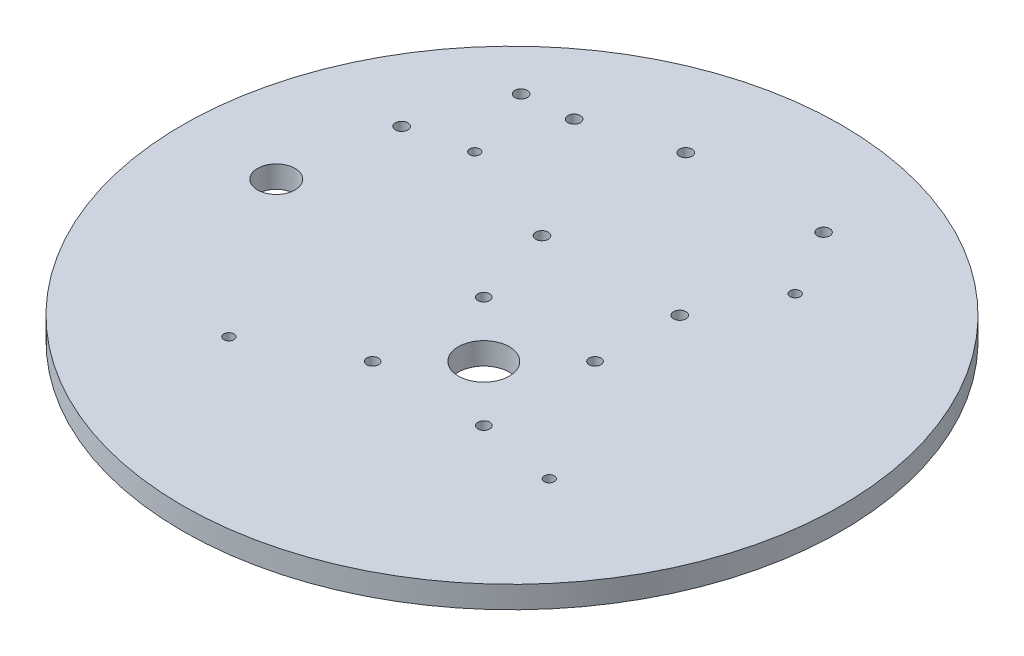
from build123d import *

# Parameters (mm, degrees)
SKETCH1_R                                        = 139.7
BOSS_EXTRUDE1_DEPTH                              = 6.35
SKETCH2_R                                        = 134.112
BOSS_EXTRUDE2_DEPTH                              = 3
BOSS_EXTRUDE3_DEPTH                              = 5
SKETCH37_R                                       = 177.8
CUT_EXTRUDE1_DEPTH                               = 268.317994245
CBORE_FOR_M4_HEX_HEAD_MACHINE_SCREW3_D           = 4.3
CBORE_FOR_M4_HEX_HEAD_MACHINE_SCREW3_CBORE_D     = 10.59
CBORE_FOR_M4_HEX_HEAD_MACHINE_SCREW3_CBORE_DEPTH = 3
CIRPATTERN1_COUNT                                = 4
F_5_8_0_625_DIAMETER_HOLE1_D                     = 15.875
SKETCH73_R                                       = 139.7
SKETCH73_R_2                                     = 134.112
BOSS_EXTRUDE4_DEPTH                              = 3
SKETCH74_R                                       = 3.81
SKETCH74_R_2                                     = 2.5
CUT_EXTRUDE5_DEPTH                               = 198.786760174
SKETCH75_R                                       = 21.59
CUT_EXTRUDE6_DEPTH                               = 1.8
SKETCH76_R                                       = 10.795
CUT_EXTRUDE7_DEPTH                               = 198.786760174
CBORE_FOR_M5_HEX_HEAD_MACHINE_SCREW1_D           = 5.3
CBORE_FOR_M5_HEX_HEAD_MACHINE_SCREW1_CBORE_D     = 11.71
CBORE_FOR_M5_HEX_HEAD_MACHINE_SCREW1_CBORE_DEPTH = 3.8
CBORE_FOR_M5_HEX_HEAD_BOLT1_D                    = 5.3
CBORE_FOR_M5_HEX_HEAD_BOLT1_CBORE_D              = 12.24
CBORE_FOR_M5_HEX_HEAD_BOLT1_CBORE_DEPTH          = 3.58
SKETCH84_R                                       = 5.855
BOSS_EXTRUDE6_DEPTH                              = 9.35
SKETCH85_R                                       = 5.295
SKETCH85_R_2                                     = 2.15
SKETCH85_R_3                                     = 21.59
SKETCH85_R_4                                     = 10.795
BOSS_EXTRUDE7_DEPTH                              = 3


with BuildPart() as part:
    # Sketch1 → Boss-Extrude1 (new body)
    with BuildSketch(Plane(origin=(0, 0, 0), x_dir=(1, 0, 0), z_dir=(0, 1, 0))):
        with Locations(Location((0, 0, 0), (0, 0, 270))):
            Circle(SKETCH1_R)
    extrude(amount=BOSS_EXTRUDE1_DEPTH)

    # Sketch2 → Boss-Extrude2 (add)
    with BuildSketch(Plane.XZ):
        with Locations(Location((0, 0, 0), (0, 0, 270))):
            Circle(SKETCH2_R)
    extrude(amount=BOSS_EXTRUDE2_DEPTH)

    # Sketch3 → Boss-Extrude3 (add, symmetric)
    with BuildSketch(Plane.XY):
        with BuildLine():
            Line((-38.1, 95.25), (-38.1, 6.35))
            Line((-38.1, 6.35), (-139.7, 6.35))
            Line((-139.7, 6.35), (-164.11656703, 72.845121962))
            ThreePointArc((-164.11656703, 72.845121962), (-114.47811829, 159.246393895), (-38.1, 95.25))
        make_face()
    extrude(amount=BOSS_EXTRUDE3_DEPTH, both=True)

    # Sketch37 → Cut-Extrude1 (cut, through all)
    with BuildSketch(Plane(origin=(0, 6.35, 0), x_dir=(1, 0, 0), z_dir=(0, 1, 0))):
        Circle(SKETCH37_R)
    extrude(amount=CUT_EXTRUDE1_DEPTH, mode=Mode.SUBTRACT)

    # CBORE for M4 Hex Head Machine Screw3 (through all)
    with Locations(Plane(origin=(0, 6.35, 0), x_dir=(1, 0, 0), z_dir=(0, 1, 0))):
        with Locations((52.109857404, 67.910888344)):
            cbore_for_m4_hex_head_machine_screw3 = CounterBoreHole(CBORE_FOR_M4_HEX_HEAD_MACHINE_SCREW3_D / 2, CBORE_FOR_M4_HEX_HEAD_MACHINE_SCREW3_CBORE_D / 2, CBORE_FOR_M4_HEX_HEAD_MACHINE_SCREW3_CBORE_DEPTH)

    # CirPattern1: CBORE for M4 Hex Head Machine Screw3 ×4 about axis
    cirpattern1_axis = Axis((0, 0, 0), (0, 1, 0))
    for i in range(1, CIRPATTERN1_COUNT):
        add(cbore_for_m4_hex_head_machine_screw3.rotate(cirpattern1_axis, i * 360 / CIRPATTERN1_COUNT), mode=Mode.SUBTRACT)

    # 5/8 (0.625) Diameter Hole1 (through all)
    with Locations(Plane(origin=(0, 6.35, 0), x_dir=(1, 0, 0), z_dir=(0, 1, 0))):
        with Locations((-99.914329603, 0)):
            Hole(F_5_8_0_625_DIAMETER_HOLE1_D / 2)

    # Sketch73 → Boss-Extrude4 (add)
    with BuildSketch(Plane.XZ):
        with Locations(Location((0, 0, 0), (0, 0, 270))):
            Circle(SKETCH73_R)
        Circle(SKETCH73_R_2, mode=Mode.SUBTRACT)
    extrude(amount=BOSS_EXTRUDE4_DEPTH)

    # Sketch74 → Cut-Extrude5 (cut, through all)
    with BuildSketch(Plane(origin=(0, 6.35, 0), x_dir=(1, 0, 0), z_dir=(0, 1, 0))):
        with Locations(Location((10.959973331, -22.913729172, 0), (0, 0, 270))):
            Circle(SKETCH74_R)
        with Locations(Location((34.529973331, -46.483729172, 0), (0, 0, 270))):
            Circle(SKETCH74_R_2)
        with Locations(Location((-12.610026669, -46.483729172, 0), (0, 0, 270))):
            Circle(SKETCH74_R_2)
        with Locations(Location((-12.610026669, 0.656270828, 0), (0, 0, 270))):
            Circle(SKETCH74_R_2)
        with Locations(Location((34.529973331, 0.656270828, 0), (0, 0, 270))):
            Circle(SKETCH74_R_2)
    extrude(amount=-CUT_EXTRUDE5_DEPTH, mode=Mode.SUBTRACT)

    # Sketch75 → Cut-Extrude6 (cut)
    with BuildSketch(Plane(origin=(0, 6.35, 0), x_dir=(1, 0, 0), z_dir=(0, 1, 0))):
        with Locations(Location((10.959973331, -22.913729172, 0), (0, 0, 270))):
            Circle(SKETCH75_R)
    extrude(amount=-CUT_EXTRUDE6_DEPTH, mode=Mode.SUBTRACT)

    # Sketch76 → Cut-Extrude7 (cut, through all)
    with BuildSketch(Plane.XZ.offset(3)):
        with Locations(Location((10.959973331, 22.913729172, 0), (0, 0, 270))):
            Circle(SKETCH76_R)
    extrude(amount=-CUT_EXTRUDE7_DEPTH, mode=Mode.SUBTRACT)

    # CBORE for M5 Hex Head Machine Screw1 (through all)
    with Locations(Plane(origin=(0, -3, 0), x_dir=(-1, 0, 0), z_dir=(0, -1, 0))):
        with Locations((-35.56, 96.52), (-35.56, 66.04), (-35.56, 35.56), (22.86, 35.56), (22.86, 66.04), (22.86, 96.52)):
            CounterBoreHole(CBORE_FOR_M5_HEX_HEAD_MACHINE_SCREW1_D / 2, CBORE_FOR_M5_HEX_HEAD_MACHINE_SCREW1_CBORE_D / 2, CBORE_FOR_M5_HEX_HEAD_MACHINE_SCREW1_CBORE_DEPTH)

    # CBORE for M5 Hex Head Bolt1 (through all)
    with Locations(Plane(origin=(-79.322298318, -3, -83.174678927), x_dir=(0, 0, -1), z_dir=(0, -1, 0))):
        with Locations((0, 0), (-37.220558849, -13.421994622), (1.981025557, 20.485311492)):
            CounterBoreHole(CBORE_FOR_M5_HEX_HEAD_BOLT1_D / 2, CBORE_FOR_M5_HEX_HEAD_BOLT1_CBORE_D / 2, CBORE_FOR_M5_HEX_HEAD_BOLT1_CBORE_DEPTH)

    # Sketch84 → Boss-Extrude6 (add)
    with BuildSketch(Plane.XZ.offset(3)):
        with Locations((35.56, -66.04)):
            Circle(SKETCH84_R)
        with Locations((-22.86, -66.04)):
            Circle(SKETCH84_R)
    extrude(amount=-BOSS_EXTRUDE6_DEPTH)

    # Sketch85 → Boss-Extrude7 (add)
    # profile 1 of 5: a face of its own
    with BuildSketch(Plane(origin=(0, 6.35, 0), x_dir=(1, 0, 0), z_dir=(0, 1, 0))):
        with Locations((-52.109857404, -67.910888344)):
            Circle(SKETCH85_R)
        with Locations(Location((-52.109857404, -67.910888344, 0), (0, 0, 270))):
            Circle(SKETCH85_R_2, mode=Mode.SUBTRACT)
    # profile 2 of 5: a face of its own
    with BuildSketch(Plane(origin=(0, 6.35, 0), x_dir=(1, 0, 0), z_dir=(0, 1, 0))):
        with Locations((67.910888344, -52.109857404)):
            Circle(SKETCH85_R)
        with Locations(Location((67.910888344, -52.109857404, 0), (0, 0, 270))):
            Circle(SKETCH85_R_2, mode=Mode.SUBTRACT)
    # profile 3 of 5: a face of its own
    with BuildSketch(Plane(origin=(0, 6.35, 0), x_dir=(1, 0, 0), z_dir=(0, 1, 0))):
        with Locations((10.959973331, -22.913729172)):
            Circle(SKETCH85_R_3)
        with Locations(Location((10.959973331, -22.913729172, 0), (0, 0, 90))):
            Circle(SKETCH85_R_4, mode=Mode.SUBTRACT)
    # profile 4 of 5: a face of its own
    with BuildSketch(Plane(origin=(0, 6.35, 0), x_dir=(1, 0, 0), z_dir=(0, 1, 0))):
        with Locations((52.109857404, 67.910888344)):
            Circle(SKETCH85_R)
        with Locations(Location((52.109857404, 67.910888344, 0), (0, 0, 270))):
            Circle(SKETCH85_R_2, mode=Mode.SUBTRACT)
    # profile 5 of 5: a face of its own
    with BuildSketch(Plane(origin=(0, 6.35, 0), x_dir=(1, 0, 0), z_dir=(0, 1, 0))):
        with Locations((-67.910888344, 52.109857404)):
            Circle(SKETCH85_R)
        with Locations(Location((-67.910888344, 52.109857404, 0), (0, 0, 270))):
            Circle(SKETCH85_R_2, mode=Mode.SUBTRACT)
    extrude(amount=-BOSS_EXTRUDE7_DEPTH)


solid = part.part
